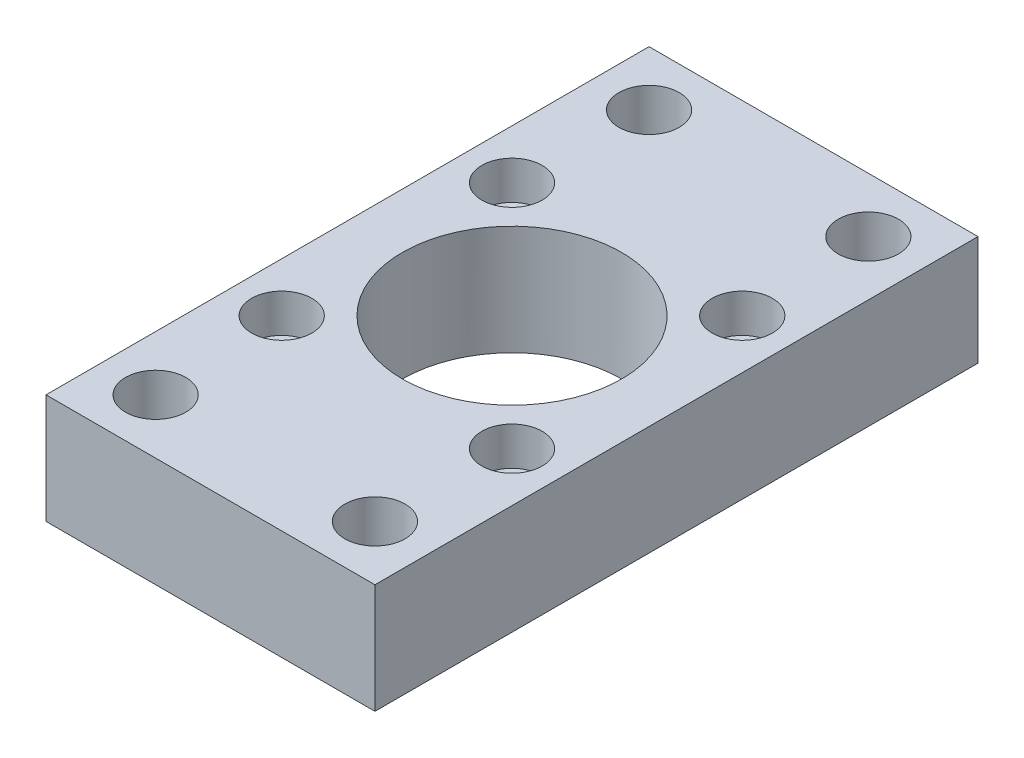
from build123d import *

# Parameters (mm, degrees)
SALIENTE_EXTRUIR1_DEPTH      = 30
SALIENTE_EXTRUIR1_DEPTH_BACK = 30
CROQUIS1_W                   = 110
CROQUIS1_H                   = 20
CORTAR_EXTRUIR1_REACH        = 67.765
CROQUIS2_R                   = 20
CROQUIS3_R                   = 5.5
CORTAR_EXTRUIR2_DEPTH        = 7
CORTAR_EXTRUIR3_REACH        = 65.984
CROQUIS4_R                   = 3.25
CORTAR_EXTRUIR4_REACH        = 67.765
CROQUIS5_R                   = 5.5


with BuildPart() as part:
    # Croquis1 → Saliente-Extruir1 (new, two sides: drawn at the far end of the back side and taken through both)
    with BuildSketch(Plane(origin=(0, 0, 0), x_dir=(0, 0, -1), z_dir=(1, 0, 0)).offset(-SALIENTE_EXTRUIR1_DEPTH_BACK)):
        with Locations((0, -10)):
            Rectangle(CROQUIS1_W, CROQUIS1_H)
    extrude(amount=SALIENTE_EXTRUIR1_DEPTH + SALIENTE_EXTRUIR1_DEPTH_BACK)

    # Croquis2 → Cortar-Extruir1 (cut, up to next)
    with BuildSketch(Plane(origin=(0, 0, 0), x_dir=(1, 0, 0), z_dir=(0, 1, 0)), mode=Mode.PRIVATE) as cortar_extruir1_sk1:
        Circle(CROQUIS2_R)
    cortar_extruir1_tool1 = extrude(cortar_extruir1_sk1.sketch, amount=-CORTAR_EXTRUIR1_REACH, mode=Mode.PRIVATE) & part.part
    add(cortar_extruir1_tool1.solids().sort_by_distance((0, 0, 0))[0], mode=Mode.SUBTRACT)

    # Croquis3 → Cortar-Extruir2 (cut)
    with BuildSketch(Plane(origin=(0, 0, 0), x_dir=(1, 0, 0), z_dir=(0, 1, 0))):
        with Locations((-21, 21)):
            Circle(CROQUIS3_R)
        with Locations((21, 21)):
            Circle(CROQUIS3_R)
        with Locations((21, -21)):
            Circle(CROQUIS3_R)
        with Locations((-21, -21)):
            Circle(CROQUIS3_R)
    extrude(amount=-CORTAR_EXTRUIR2_DEPTH, mode=Mode.SUBTRACT)

    # Croquis4 → Cortar-Extruir3 (cut, up to next)
    with BuildSketch(Plane(origin=(0, -7, 0), x_dir=(1, 0, 0), z_dir=(0, 1, 0)), mode=Mode.PRIVATE) as cortar_extruir3_sk1:
        with Locations((-21, 21)):
            Circle(CROQUIS4_R)
    cortar_extruir3_tool1 = extrude(cortar_extruir3_sk1.sketch, amount=-CORTAR_EXTRUIR3_REACH, mode=Mode.PRIVATE) & part.part
    # Croquis4 → Cortar-Extruir3 (cut, up to next)
    with BuildSketch(Plane(origin=(0, -7, 0), x_dir=(1, 0, 0), z_dir=(0, 1, 0)), mode=Mode.PRIVATE) as cortar_extruir3_sk2:
        with Locations((21, 21)):
            Circle(CROQUIS4_R)
    cortar_extruir3_tool2 = extrude(cortar_extruir3_sk2.sketch, amount=-CORTAR_EXTRUIR3_REACH, mode=Mode.PRIVATE) & part.part
    # Croquis4 → Cortar-Extruir3 (cut, up to next)
    with BuildSketch(Plane(origin=(0, -7, 0), x_dir=(1, 0, 0), z_dir=(0, 1, 0)), mode=Mode.PRIVATE) as cortar_extruir3_sk3:
        with Locations((21, -21)):
            Circle(CROQUIS4_R)
    cortar_extruir3_tool3 = extrude(cortar_extruir3_sk3.sketch, amount=-CORTAR_EXTRUIR3_REACH, mode=Mode.PRIVATE) & part.part
    # Croquis4 → Cortar-Extruir3 (cut, up to next)
    with BuildSketch(Plane(origin=(0, -7, 0), x_dir=(1, 0, 0), z_dir=(0, 1, 0)), mode=Mode.PRIVATE) as cortar_extruir3_sk4:
        with Locations((-21, -21)):
            Circle(CROQUIS4_R)
    cortar_extruir3_tool4 = extrude(cortar_extruir3_sk4.sketch, amount=-CORTAR_EXTRUIR3_REACH, mode=Mode.PRIVATE) & part.part
    add(cortar_extruir3_tool1.solids().sort_by_distance((-21, -7, -21))[0], mode=Mode.SUBTRACT)
    add(cortar_extruir3_tool2.solids().sort_by_distance((21, -7, -21))[0], mode=Mode.SUBTRACT)
    add(cortar_extruir3_tool3.solids().sort_by_distance((21, -7, 21))[0], mode=Mode.SUBTRACT)
    add(cortar_extruir3_tool4.solids().sort_by_distance((-21, -7, 21))[0], mode=Mode.SUBTRACT)

    # Croquis5 → Cortar-Extruir4 (cut, up to next)
    with BuildSketch(Plane(origin=(0, 0, 0), x_dir=(1, 0, 0), z_dir=(0, 1, 0)), mode=Mode.PRIVATE) as cortar_extruir4_sk1:
        with Locations((-20, 45)):
            Circle(CROQUIS5_R)
    cortar_extruir4_tool1 = extrude(cortar_extruir4_sk1.sketch, amount=-CORTAR_EXTRUIR4_REACH, mode=Mode.PRIVATE) & part.part
    # Croquis5 → Cortar-Extruir4 (cut, up to next)
    with BuildSketch(Plane(origin=(0, 0, 0), x_dir=(1, 0, 0), z_dir=(0, 1, 0)), mode=Mode.PRIVATE) as cortar_extruir4_sk2:
        with Locations((20, 45)):
            Circle(CROQUIS5_R)
    cortar_extruir4_tool2 = extrude(cortar_extruir4_sk2.sketch, amount=-CORTAR_EXTRUIR4_REACH, mode=Mode.PRIVATE) & part.part
    # Croquis5 → Cortar-Extruir4 (cut, up to next)
    with BuildSketch(Plane(origin=(0, 0, 0), x_dir=(1, 0, 0), z_dir=(0, 1, 0)), mode=Mode.PRIVATE) as cortar_extruir4_sk3:
        with Locations((20, -45)):
            Circle(CROQUIS5_R)
    cortar_extruir4_tool3 = extrude(cortar_extruir4_sk3.sketch, amount=-CORTAR_EXTRUIR4_REACH, mode=Mode.PRIVATE) & part.part
    # Croquis5 → Cortar-Extruir4 (cut, up to next)
    with BuildSketch(Plane(origin=(0, 0, 0), x_dir=(1, 0, 0), z_dir=(0, 1, 0)), mode=Mode.PRIVATE) as cortar_extruir4_sk4:
        with Locations((-20, -45)):
            Circle(CROQUIS5_R)
    cortar_extruir4_tool4 = extrude(cortar_extruir4_sk4.sketch, amount=-CORTAR_EXTRUIR4_REACH, mode=Mode.PRIVATE) & part.part
    add(cortar_extruir4_tool1.solids().sort_by_distance((-20, 0, -45))[0], mode=Mode.SUBTRACT)
    add(cortar_extruir4_tool2.solids().sort_by_distance((20, 0, -45))[0], mode=Mode.SUBTRACT)
    add(cortar_extruir4_tool3.solids().sort_by_distance((20, 0, 45))[0], mode=Mode.SUBTRACT)
    add(cortar_extruir4_tool4.solids().sort_by_distance((-20, 0, 45))[0], mode=Mode.SUBTRACT)


solid = part.part
